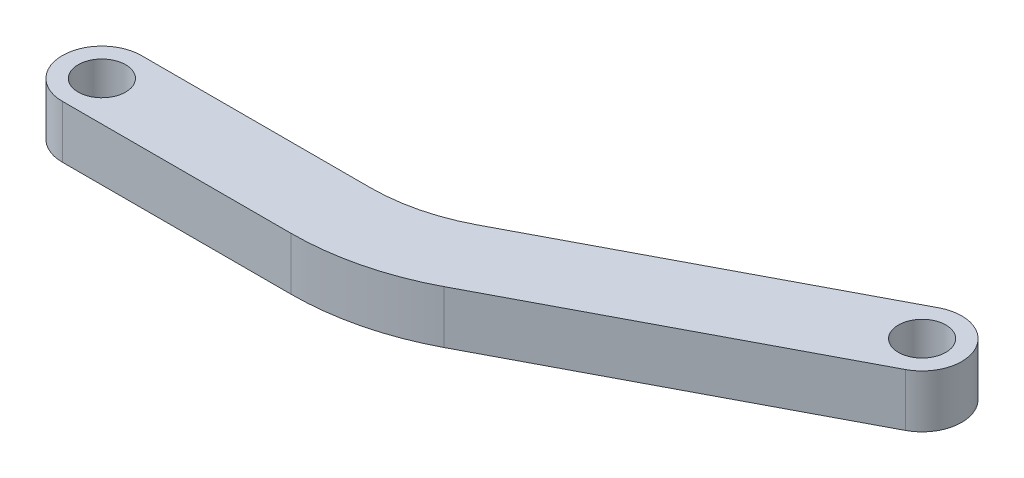
from build123d import *

# Parameters (mm, degrees)
SKETCH1_R           = 2.7
BOSS_EXTRUDE1_DEPTH = 6


with BuildPart() as part:
    # Sketch1 → Boss-Extrude1 (new body)
    with BuildSketch(Plane(origin=(0, 0, 0), x_dir=(1, 0, 0), z_dir=(0, 1, 0))):
        with BuildLine():
            Line((0, -4.5), (25.98, -4.5))
            ThreePointArc((25.98, -4.5), (33.164230321, -3.627080779), (39.930377125, -1.059122313))
            Line((39.930377125, -1.059122313), (74.342556569, 17.016131653))
            ThreePointArc((74.342556569, 17.016131653), (76.233868347, 23.092556569), (70.157443431, 24.983868347))
            Line((70.157443431, 24.983868347), (35.745263988, 6.908614381))
            ThreePointArc((35.745263988, 6.908614381), (31.008961224, 5.111043455), (25.98, 4.5))
            Line((25.98, 4.5), (0, 4.5))
            ThreePointArc((0, 4.5), (-4.5, 0), (0, -4.5))
        make_face()
        with Locations(Location((0, 0, 0), (0, 0, 270))):
            Circle(SKETCH1_R, mode=Mode.SUBTRACT)
        with Locations(Location((72.25, 21, 0), (0, 0, 270))):
            Circle(SKETCH1_R, mode=Mode.SUBTRACT)
    extrude(amount=BOSS_EXTRUDE1_DEPTH)


solid = part.part
